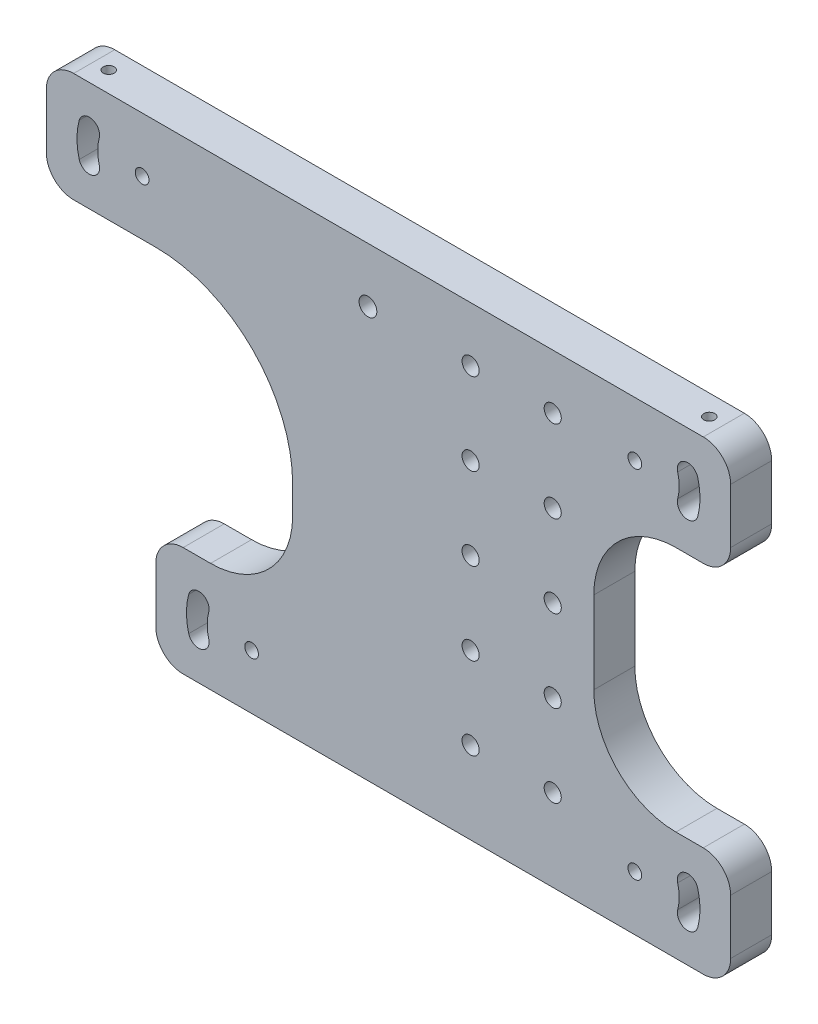
from build123d import *

# Parameters (mm, degrees)
MODEL_R             = 3.96875
MODEL_R_2           = 3.175
MODEL_R_3           = 4.1275
BOSS_EXTRUDE1_DEPTH = 19.05
CUT_EXTRUDE1_REACH  = 492.168
SKETCH2_R           = 2.5527
CUT_EXTRUDE2_REACH  = 492.168
SKETCH3_R           = 2.5527


with BuildPart() as part:
    # Model → Boss-Extrude1 (new body)
    with BuildSketch(Plane.XY):
        with BuildLine():
            Line((414.246385051, 270.805422424), (426.946385051, 270.805422424))
            ThreePointArc((426.946385051, 270.805422424), (435.926641172, 274.525166302), (439.646385051, 283.505422424))
            Line((439.646385051, 283.505422424), (439.646385051, 308.905422424))
            ThreePointArc((439.646385051, 308.905422424), (435.926641172, 317.885678545), (426.946385051, 321.605422424))
            Line((426.946385051, 321.605422424), (134.846385051, 321.605422424))
            ThreePointArc((134.846385051, 321.605422424), (125.86612893, 317.885678545), (122.146385051, 308.905422424))
            Line((122.146385051, 308.905422424), (122.146385051, 283.505422424))
            ThreePointArc((122.146385051, 283.505422424), (125.86612893, 274.525166302), (134.846385051, 270.805422424))
            Line((134.846385051, 270.805422424), (172.946385051, 270.805422424))
            ThreePointArc((172.946385051, 270.805422424), (217.847665656, 252.206703029), (236.446385051, 207.305422424))
            Line((236.446385051, 207.305422424), (236.446385051, 194.605422424))
            ThreePointArc((236.446385051, 194.605422424), (225.287153414, 167.66465406), (198.346385051, 156.505422424))
            Line((198.346385051, 156.505422424), (185.646385051, 156.505422424))
            ThreePointArc((185.646385051, 156.505422424), (176.66612893, 152.785678545), (172.946385051, 143.805422424))
            Line((172.946385051, 143.805422424), (172.946385051, 118.405422424))
            ThreePointArc((172.946385051, 118.405422424), (176.66612893, 109.425166302), (185.646385051, 105.705422424))
            Line((185.646385051, 105.705422424), (426.946385051, 105.705422424))
            ThreePointArc((426.946385051, 105.705422424), (435.926641172, 109.425166302), (439.646385051, 118.405422424))
            Line((439.646385051, 118.405422424), (439.646385051, 143.805422424))
            ThreePointArc((439.646385051, 143.805422424), (435.926641172, 152.785678545), (426.946385051, 156.505422424))
            Line((426.946385051, 156.505422424), (414.246385051, 156.505422424))
            ThreePointArc((414.246385051, 156.505422424), (387.305616688, 167.66465406), (376.146385051, 194.605422424))
            Line((376.146385051, 194.605422424), (376.146385051, 232.705422424))
            ThreePointArc((376.146385051, 232.705422424), (387.305616688, 259.646190787), (414.246385051, 270.805422424))
        make_face()
        with Locations(Location((357.096385051, 143.805422424, 0), (0, 0, 180))):
            Circle(MODEL_R, mode=Mode.SUBTRACT)
        with Locations(Location((357.096385051, 220.005422424, 0), (0, 0, 180))):
            Circle(MODEL_R, mode=Mode.SUBTRACT)
        with Locations(Location((357.096385051, 181.905422424, 0), (0, 0, 180))):
            Circle(MODEL_R, mode=Mode.SUBTRACT)
        with Locations(Location((395.196385051, 296.205422424, 0), (0, 0, 180))):
            Circle(MODEL_R_2, mode=Mode.SUBTRACT)
        with Locations(Location((357.096385051, 258.105422424, 0), (0, 0, 180))):
            Circle(MODEL_R, mode=Mode.SUBTRACT)
        with Locations(Location((357.096385051, 296.205422424, 0), (0, 0, 180))):
            Circle(MODEL_R, mode=Mode.SUBTRACT)
        with Locations(Location((271.371385051, 296.205422424, 0), (0, 0, 180))):
            Circle(MODEL_R_3, mode=Mode.SUBTRACT)
        with Locations(Location((318.996385051, 296.205422424, 0), (0, 0, 180))):
            Circle(MODEL_R, mode=Mode.SUBTRACT)
        with Locations(Location((318.996385051, 258.105422424, 0), (0, 0, 180))):
            Circle(MODEL_R, mode=Mode.SUBTRACT)
        with Locations(Location((166.596385051, 296.205422424, 0), (0, 0, 180))):
            Circle(MODEL_R_2, mode=Mode.SUBTRACT)
        with Locations(Location((318.996385051, 181.905422424, 0), (0, 0, 180))):
            Circle(MODEL_R, mode=Mode.SUBTRACT)
        with Locations(Location((395.196385051, 131.105422424, 0), (0, 0, 180))):
            Circle(MODEL_R_2, mode=Mode.SUBTRACT)
        with Locations(Location((318.996385051, 220.005422424, 0), (0, 0, 180))):
            Circle(MODEL_R, mode=Mode.SUBTRACT)
        with Locations(Location((318.996385051, 143.805422424, 0), (0, 0, 180))):
            Circle(MODEL_R, mode=Mode.SUBTRACT)
        with Locations(Location((217.396385051, 131.105422424, 0), (0, 0, 180))):
            Circle(MODEL_R_2, mode=Mode.SUBTRACT)
        with BuildLine():
            ThreePointArc((197.516747869, 136.500214247), (196.806510051, 131.105422424), (197.516747869, 125.7106306))
            ThreePointArc((197.516747869, 125.7106306), (194.115475863, 119.819454675), (188.224299938, 123.220726681))
            ThreePointArc((188.224299938, 123.220726681), (187.186260051, 131.105422424), (188.224299938, 138.990118166))
            ThreePointArc((188.224299938, 138.990118166), (194.115475863, 142.391390172), (197.516747869, 136.500214247))
        make_face(mode=Mode.SUBTRACT)
        with BuildLine():
            ThreePointArc((424.368470164, 123.220726681), (425.406510051, 131.105422424), (424.368470164, 138.990118166))
            ThreePointArc((424.368470164, 138.990118166), (418.477294239, 142.391390172), (415.076022233, 136.500214247))
            ThreePointArc((415.076022233, 136.500214247), (415.786260051, 131.105422424), (415.076022233, 125.7106306))
            ThreePointArc((415.076022233, 125.7106306), (418.477294239, 119.819454675), (424.368470164, 123.220726681))
        make_face(mode=Mode.SUBTRACT)
        with BuildLine():
            ThreePointArc((137.424299938, 304.090118166), (136.386260051, 296.205422424), (137.424299938, 288.320726681))
            ThreePointArc((137.424299938, 288.320726681), (143.315475863, 284.919454675), (146.716747869, 290.8106306))
            ThreePointArc((146.716747869, 290.8106306), (146.006510051, 296.205422424), (146.716747869, 301.600214247))
            ThreePointArc((146.716747869, 301.600214247), (143.315475863, 307.491390172), (137.424299938, 304.090118166))
        make_face(mode=Mode.SUBTRACT)
        with BuildLine():
            ThreePointArc((415.076022233, 290.8106306), (415.786260051, 296.205422424), (415.076022233, 301.600214247))
            ThreePointArc((415.076022233, 301.600214247), (418.477294239, 307.491390172), (424.368470164, 304.090118166))
            ThreePointArc((424.368470164, 304.090118166), (425.406510051, 296.205422424), (424.368470164, 288.320726681))
            ThreePointArc((424.368470164, 288.320726681), (418.477294239, 284.919454675), (415.076022233, 290.8106306))
        make_face(mode=Mode.SUBTRACT)
    extrude(amount=BOSS_EXTRUDE1_DEPTH)

    # Sketch2 → Cut-Extrude1 (cut, up to next)
    with BuildSketch(Plane.XZ.offset(-105.705422424), mode=Mode.PRIVATE) as cut_extrude1_sk1:
        with Locations((192.377385051, 9.525)):
            Circle(SKETCH2_R)
    cut_extrude1_tool1 = extrude(cut_extrude1_sk1.sketch, amount=-CUT_EXTRUDE1_REACH, mode=Mode.PRIVATE) & part.part
    # Sketch2 → Cut-Extrude1 (cut, up to next)
    with BuildSketch(Plane.XZ.offset(-105.705422424), mode=Mode.PRIVATE) as cut_extrude1_sk2:
        with Locations((420.215385051, 9.525)):
            Circle(SKETCH2_R)
    cut_extrude1_tool2 = extrude(cut_extrude1_sk2.sketch, amount=-CUT_EXTRUDE1_REACH, mode=Mode.PRIVATE) & part.part
    add(cut_extrude1_tool1.solids().sort_by_distance((192.377385, 105.705422, 9.525))[0], mode=Mode.SUBTRACT)
    add(cut_extrude1_tool2.solids().sort_by_distance((420.215385, 105.705422, 9.525))[0], mode=Mode.SUBTRACT)

    # Sketch3 → Cut-Extrude2 (cut, up to next)
    with BuildSketch(Plane(origin=(0, 321.605422424, 0), x_dir=(1, 0, 0), z_dir=(0, 1, 0)), mode=Mode.PRIVATE) as cut_extrude2_sk1:
        with Locations(Location((141.577385051, -9.525, 0), (0, 0, 180))):
            Circle(SKETCH3_R)
    cut_extrude2_tool1 = extrude(cut_extrude2_sk1.sketch, amount=-CUT_EXTRUDE2_REACH, mode=Mode.PRIVATE) & part.part
    # Sketch3 → Cut-Extrude2 (cut, up to next)
    with BuildSketch(Plane(origin=(0, 321.605422424, 0), x_dir=(1, 0, 0), z_dir=(0, 1, 0)), mode=Mode.PRIVATE) as cut_extrude2_sk2:
        with Locations((420.215385051, -9.525)):
            Circle(SKETCH3_R)
    cut_extrude2_tool2 = extrude(cut_extrude2_sk2.sketch, amount=-CUT_EXTRUDE2_REACH, mode=Mode.PRIVATE) & part.part
    add(cut_extrude2_tool1.solids().sort_by_distance((141.577385, 321.605422, 9.525))[0], mode=Mode.SUBTRACT)
    add(cut_extrude2_tool2.solids().sort_by_distance((420.215385, 321.605422, 9.525))[0], mode=Mode.SUBTRACT)


solid = part.part
